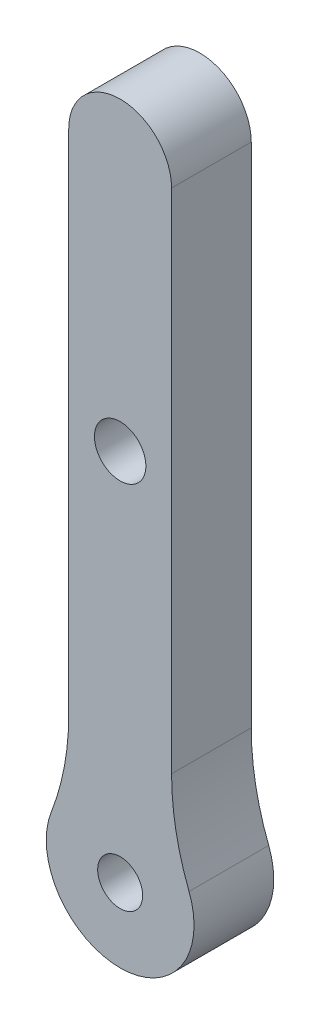
from build123d import *

# Parameters (mm, degrees)
SKETCH1_R           = 1.11125
BOSS_EXTRUDE1_DEPTH = 3.937
SKETCH2_R           = 1.27
CUT_EXTRUDE1_DEPTH  = 37.36946133


with BuildPart() as part:
    # Sketch1 → Boss-Extrude1 (new body)
    with BuildSketch(Plane.XY):
        with BuildLine():
            Line((-7.3406, 30.988), (-7.3406, 5.92501279))
            ThreePointArc((-7.3406, 5.92501279), (-7.122958425, 3.583917287), (-6.477493204, 1.323061108))
            ThreePointArc((-6.477493204, 1.323061108), (-9.8806, -3.65125), (-13.283706796, 1.323061108))
            ThreePointArc((-13.283706796, 1.323061108), (-12.638241575, 3.583917287), (-12.4206, 5.92501279))
            Line((-12.4206, 5.92501279), (-12.4206, 30.988))
            ThreePointArc((-12.4206, 30.988), (-9.8806, 33.528), (-7.3406, 30.988))
        make_face()
        with Locations(Location((-9.8806, 0, 0), (0, 0, 180))):
            Circle(SKETCH1_R, mode=Mode.SUBTRACT)
    extrude(amount=BOSS_EXTRUDE1_DEPTH)

    # Sketch2 → Cut-Extrude1 (cut, through all)
    with BuildSketch(Plane(origin=(0, 0, 0), x_dir=(-1, 0, 0), z_dir=(0, 0, -1))):
        with Locations((9.8806, 18.456506395)):
            Circle(SKETCH2_R)
    extrude(amount=-CUT_EXTRUDE1_DEPTH, mode=Mode.SUBTRACT)


solid = part.part
